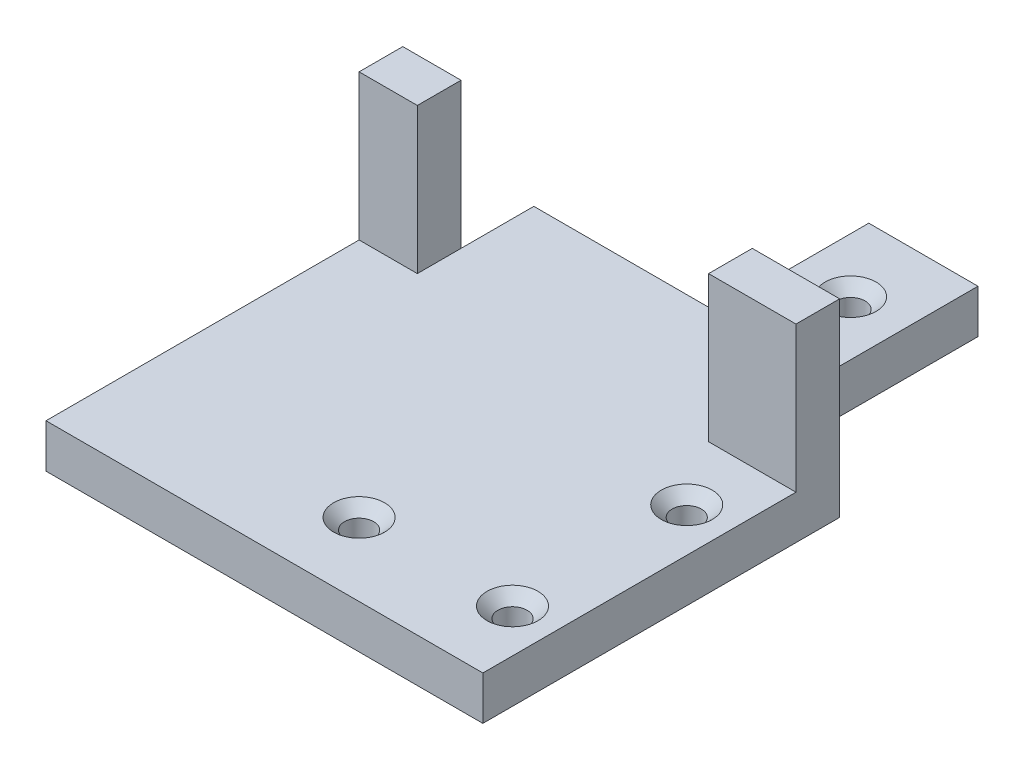
from build123d import *

# Parameters (mm, degrees)
SKETCH1_W           = 60
SKETCH1_H           = 80
BOSS_EXTRUDE1_DEPTH = 6
SKETCH2_R           = 2
CUT_EXTRUDE1_DEPTH  = 51.358713248
SKETCH3_W           = 12
SKETCH3_H           = 6
SKETCH3_W_2         = 8
BOSS_EXTRUDE2_DEPTH = 20
CHAMFER1_SIZE       = 1.5


with BuildPart() as part:
    # Sketch1 → Boss-Extrude1 (new body)
    with BuildSketch(Plane(origin=(0, 0, 0), x_dir=(1, 0, 0), z_dir=(0, 1, 0))):
        Rectangle(SKETCH1_W, SKETCH1_H)
    extrude(amount=BOSS_EXTRUDE1_DEPTH)

    # Sketch2 → Cut-Extrude1 (cut, through all)
    with BuildSketch(Plane(origin=(0, 6, 0), x_dir=(1, 0, 0), z_dir=(0, 1, 0))):
        with Locations(Location((3, -30, 0), (0, 0, 270))):
            Circle(SKETCH2_R)
        with Locations(Location((24.071589502, -30, 0), (0, 0, 270))):
            Circle(SKETCH2_R)
        with Locations(Location((24, -6, 0), (0, 0, 270))):
            Circle(SKETCH2_R)
        with Locations(Location((10.5, 30, 0), (0, 0, 270))):
            Circle(SKETCH2_R)
        Polygon((-40.891606185, 9), (-22, 9), (-22, 19), (3, 19), (3, 40), (18, 40), (18, 9), (35.945141675, 9), (35.945141675, 57.336722716), (-40.891606185, 57.336722716), align=None)
    extrude(amount=-CUT_EXTRUDE1_DEPTH, mode=Mode.SUBTRACT)

    # Sketch3 → Boss-Extrude2 (add)
    with BuildSketch(Plane(origin=(0, 6, 0), x_dir=(1, 0, 0), z_dir=(0, 1, 0))):
        with Locations((24, 6)):
            Rectangle(SKETCH3_W, SKETCH3_H)
        with Locations((-26, 6)):
            Rectangle(SKETCH3_W_2, SKETCH3_H)
    extrude(amount=BOSS_EXTRUDE2_DEPTH)

    # Chamfer1
    chamfer1_edges = [part.edges().sort_by_distance(p)[0] for p in [
        (3, 6, 28),
        (24.071589502, 6, 28),
        (24, 6, 4),
        (10.5, 6, -32),
    ]]
    chamfer(chamfer1_edges, length=CHAMFER1_SIZE)


solid = part.part
